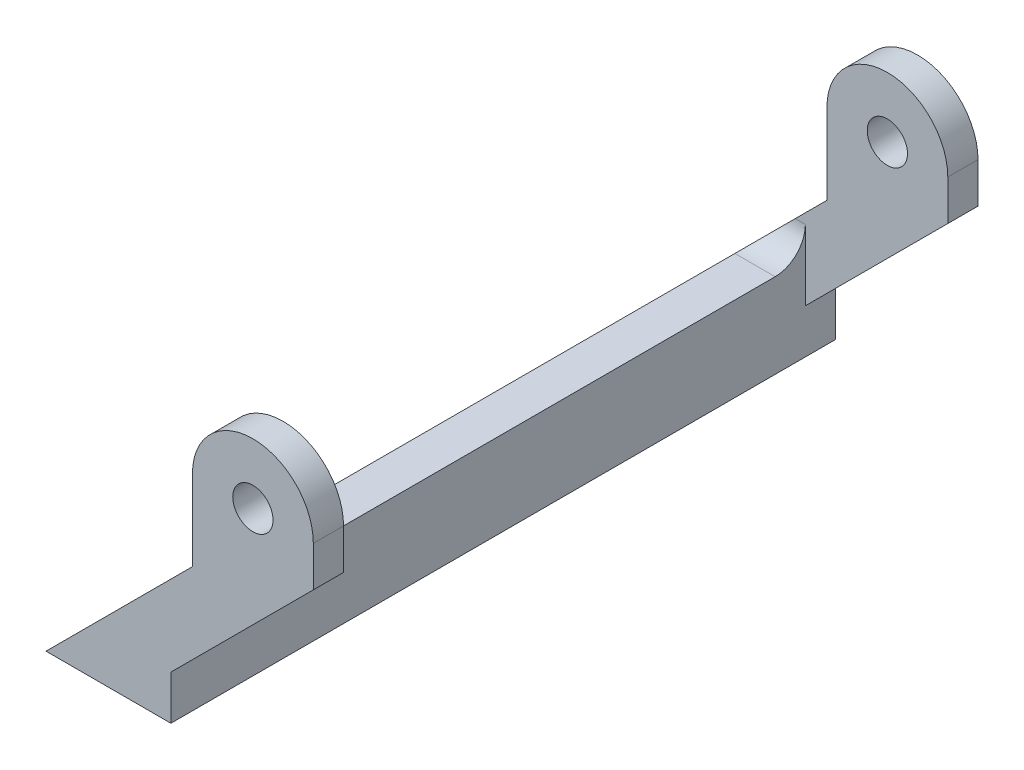
from build123d import *

# Parameters (mm, degrees)
EXTRUDE1_DEPTH = 3
EXTRUDE2_DEPTH = 66
EXTRUDE3_START = -3
EXTRUDE3_DEPTH = 3
SKETCH2_R      = 2
EXTRUDE4_DEPTH = 3
EXTRUDE5_START = -3
SKETCH6_R      = 2
EXTRUDE5_DEPTH = 3
FILLET3_R      = 3


with BuildPart() as part:
    # Sketch1 → Extrude1 (new body)
    with BuildSketch(Plane.XY):
        with BuildLine():
            Line((-8.805401881, -5.201299994), (-2.663266257, 0.94083563))
            Line((-2.663266257, 0.94083563), (-2.663266257, 8.94083563))
            ThreePointArc((-2.663266257, 8.94083563), (3.336733743, 14.94083563), (9.336733743, 8.94083563))
            Line((9.336733743, 8.94083563), (9.336733743, 4.94083563))
            Line((9.336733743, 4.94083563), (-4.805401881, -9.201299994))
            Line((-4.805401881, -9.201299994), (-4.805401881, -5.201299994))
            Line((-4.805401881, -5.201299994), (-8.805401881, -5.201299994))
        make_face()
    extrude(amount=EXTRUDE1_DEPTH)

    # Sketch3 → Extrude2 (add)
    with BuildSketch(Plane.XY):
        Polygon((-8.805401881, -5.201299994), (-4.805401881, -5.201299994), (-4.805401881, -13.601299994), (-17.205401881, -13.601299994), align=None)
    extrude(amount=EXTRUDE2_DEPTH)

    # Sketch4 → Extrude3 (add)
    with BuildSketch(Plane.XY.offset(66).offset(EXTRUDE3_START)):
        with BuildLine():
            Line((-8.805401881, -5.201299994), (-4.805401881, -5.201299994))
            Line((-4.805401881, -5.201299994), (-4.805401881, -9.201299994))
            Line((-4.805401881, -9.201299994), (9.336733743, 4.94083563))
            Line((9.336733743, 4.94083563), (9.336733743, 8.94083563))
            ThreePointArc((9.336733743, 8.94083563), (3.336733743, 14.94083563), (-2.663266257, 8.94083563))
            Line((-2.663266257, 8.94083563), (-2.663266257, 0.94083563))
            Line((-2.663266257, 0.94083563), (-8.805401881, -5.201299994))
        make_face()
    extrude(amount=EXTRUDE3_DEPTH)

    # Sketch2 → Extrude4 (cut)
    with BuildSketch(Plane.XY.offset(3)):
        with Locations((3.336733743, 8.94083563)):
            Circle(SKETCH2_R)
    extrude(amount=-EXTRUDE4_DEPTH, mode=Mode.SUBTRACT)

    # Sketch6 → Extrude5 (cut)
    with BuildSketch(Plane(origin=(0, 0, 63), x_dir=(-1, 0, 0), z_dir=(0, 0, -1)).offset(EXTRUDE5_START)):
        with Locations(Location((-3.336733743, 8.94083563, 0), (0, 0, 180))):
            Circle(SKETCH6_R)
    extrude(amount=EXTRUDE5_DEPTH, mode=Mode.SUBTRACT)

    # Fillet3
    fillet3_edges = [part.edges().sort_by_distance(p)[0] for p in [
        (-6.805401881, -5.201299994, 3),
        (-6.805401881, -5.201299994, 63),
    ]]
    fillet(fillet3_edges, radius=FILLET3_R)


solid = part.part
